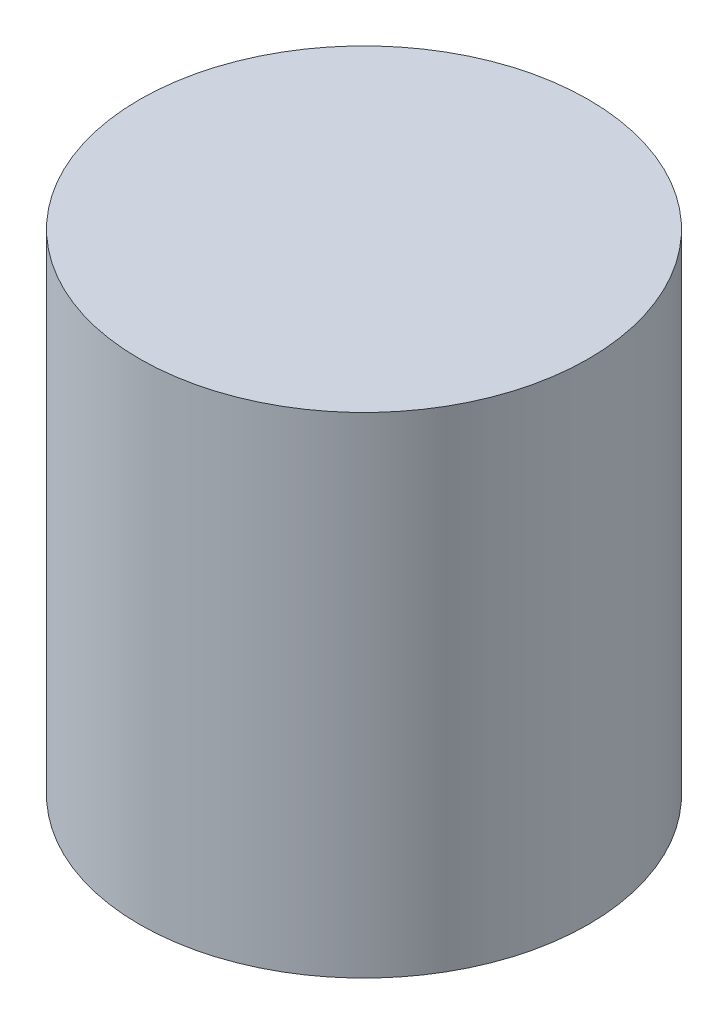
from build123d import *

# Parameters (mm, degrees)
SKETCH1_R           = 5.5
BOSS_EXTRUDE1_DEPTH = 12


with BuildPart() as part:
    # Sketch1 → Boss-Extrude1 (new body)
    with BuildSketch(Plane(origin=(0, 0, 0), x_dir=(1, 0, 0), z_dir=(0, 1, 0))):
        with Locations(Location((0, 0, 0), (0, 0, 270))):
            Circle(SKETCH1_R)
    extrude(amount=BOSS_EXTRUDE1_DEPTH)


solid = part.part
